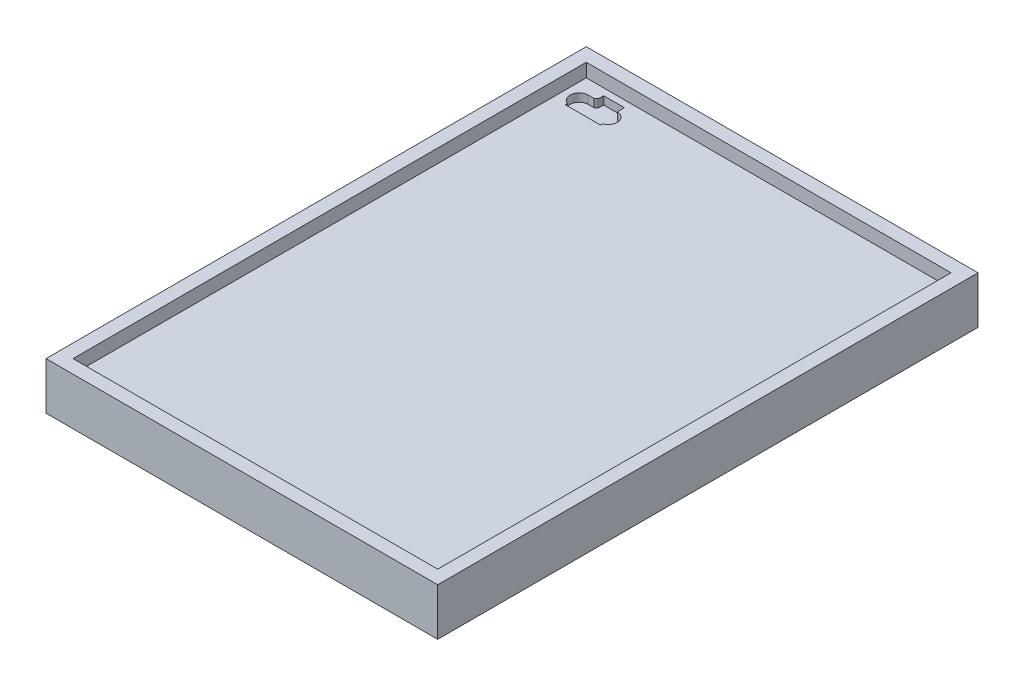
from build123d import *

# Parameters (mm, degrees)
SKETCH1_W           = 290
SKETCH1_H           = 400
BOSS_EXTRUDE1_DEPTH = 35
SKETCH2_W           = 270
SKETCH2_H           = 380
CUT_EXTRUDE2_DEPTH  = 10
CUT_EXTRUDE3_DEPTH  = 6
FILLET2_R           = 2
FILLET4_R           = 0.5
FILLET5_R           = 0.5
FILLET6_R           = 0.5
FILLET7_R           = 0.5
FILLET8_R           = 0.5
FILLET9_R           = 0.5


with BuildPart() as part:
    # Sketch1 → Boss-Extrude1 (new body)
    with BuildSketch(Plane(origin=(0, 0, 0), x_dir=(1, 0, 0), z_dir=(0, 1, 0))):
        Rectangle(SKETCH1_W, SKETCH1_H)
    extrude(amount=BOSS_EXTRUDE1_DEPTH)

    # Sketch2 → Cut-Extrude2 (cut)
    with BuildSketch(Plane(origin=(0, 35, 0), x_dir=(1, 0, 0), z_dir=(0, 1, 0))):
        Rectangle(SKETCH2_W, SKETCH2_H)
    extrude(amount=-CUT_EXTRUDE2_DEPTH, mode=Mode.SUBTRACT)

    # Sketch3 → Cut-Extrude3 (cut)
    with BuildSketch(Plane(origin=(0, 25, 0), x_dir=(1, 0, 0), z_dir=(0, 1, 0))):
        with BuildLine():
            Line((-101.75, 185), (-117.13, 185))
            Line((-117.13, 185), (-117.13, 181.5))
            Line((-117.13, 181.5), (-118.879314151, 179.7))
            Line((-118.879314151, 179.7), (-123.25, 179.7))
            ThreePointArc((-123.25, 179.7), (-129.894170377, 174.14058809), (-125.593842998, 166.62))
            Line((-125.593842998, 166.62), (-125.593842998, 165))
            Line((-125.593842998, 165), (-99.406157002, 165))
            Line((-99.406157002, 165), (-99.406157002, 166.62))
            ThreePointArc((-99.406157002, 166.62), (-95.105829623, 174.14058809), (-101.75, 179.7))
            Line((-101.75, 179.7), (-101.75, 185))
        make_face()
    extrude(amount=-CUT_EXTRUDE3_DEPTH, mode=Mode.SUBTRACT)

    # Fillet2
    fillet2_edges = [part.edges().sort_by_distance(p)[0] for p in [
        (-117.13, 22, -181.5),
    ]]
    fillet(fillet2_edges, radius=FILLET2_R)

    # Fillet4
    fillet4_edges = [part.edges().sort_by_distance(p)[0] for p in [
        (-125.593842998, 22, -166.62),
    ]]
    fillet(fillet4_edges, radius=FILLET4_R)

    # Fillet5
    fillet5_edges = [part.edges().sort_by_distance(p)[0] for p in [
        (-99.406157002, 22, -166.62),
    ]]
    fillet(fillet5_edges, radius=FILLET5_R)

    # Fillet6
    fillet6_edges = [part.edges().sort_by_distance(p)[0] for p in [
        (-101.75, 22, -179.7),
    ]]
    fillet(fillet6_edges, radius=FILLET6_R)

    # Fillet7
    fillet7_edges = [part.edges().sort_by_distance(p)[0] for p in [
        (-101.75, 22, -185),
    ]]
    fillet(fillet7_edges, radius=FILLET7_R)

    # Fillet8
    fillet8_edges = [part.edges().sort_by_distance(p)[0] for p in [
        (-117.13, 22, -185),
    ]]
    fillet(fillet8_edges, radius=FILLET8_R)

    # Fillet9
    fillet9_edges = [part.edges().sort_by_distance(p)[0] for p in [
        (-125.593842998, 22, -165),
        (-99.406157002, 22, -165),
    ]]
    fillet(fillet9_edges, radius=FILLET9_R)


solid = part.part
